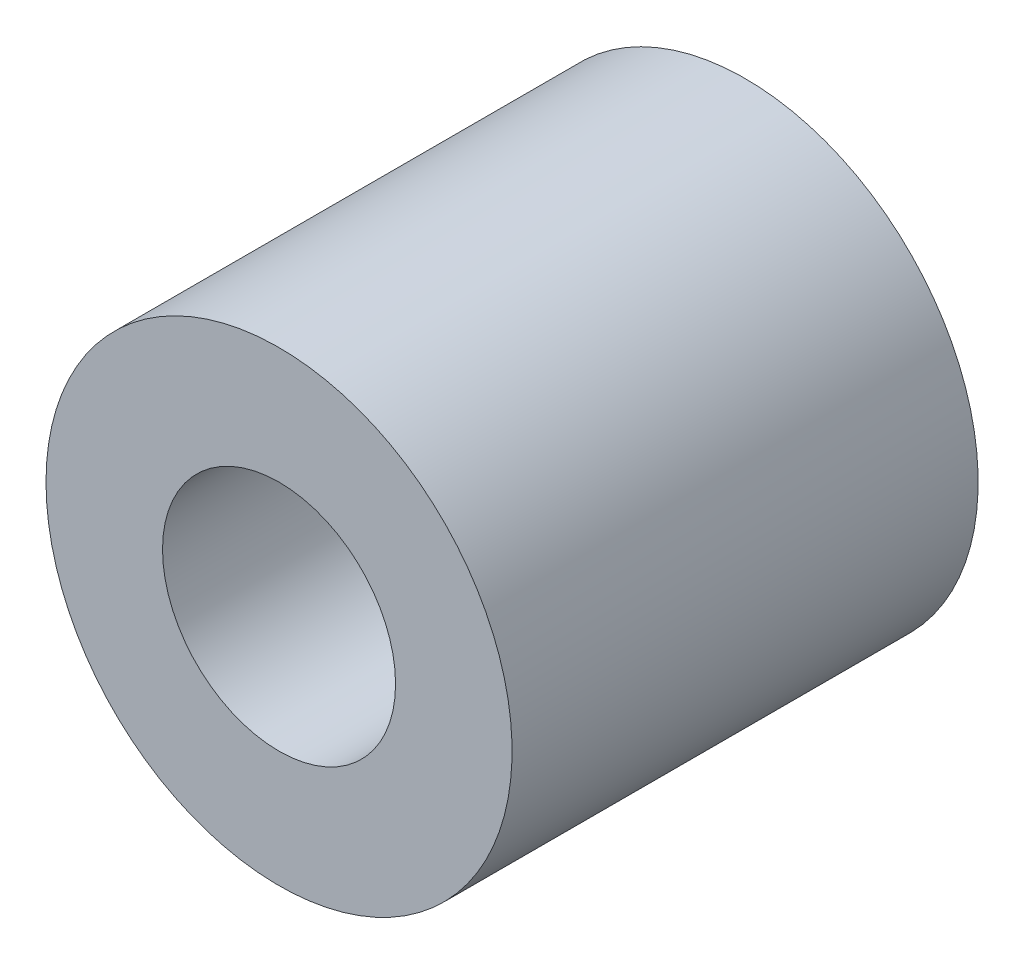
from build123d import *

# Parameters (mm, degrees)
SKETCH1_R           = 9.525
SKETCH1_R_2         = 4.7625
BOSS_EXTRUDE1_DEPTH = 9.525


with BuildPart() as part:
    # Sketch1 → Boss-Extrude1 (new, symmetric)
    with BuildSketch(Plane.XY):
        with Locations(Location((0, 0, 0), (0, 0, 180))):
            Circle(SKETCH1_R)
        with Locations(Location((0, 0, 0), (0, 0, 180))):
            Circle(SKETCH1_R_2, mode=Mode.SUBTRACT)
    extrude(amount=BOSS_EXTRUDE1_DEPTH, both=True)


solid = part.part
